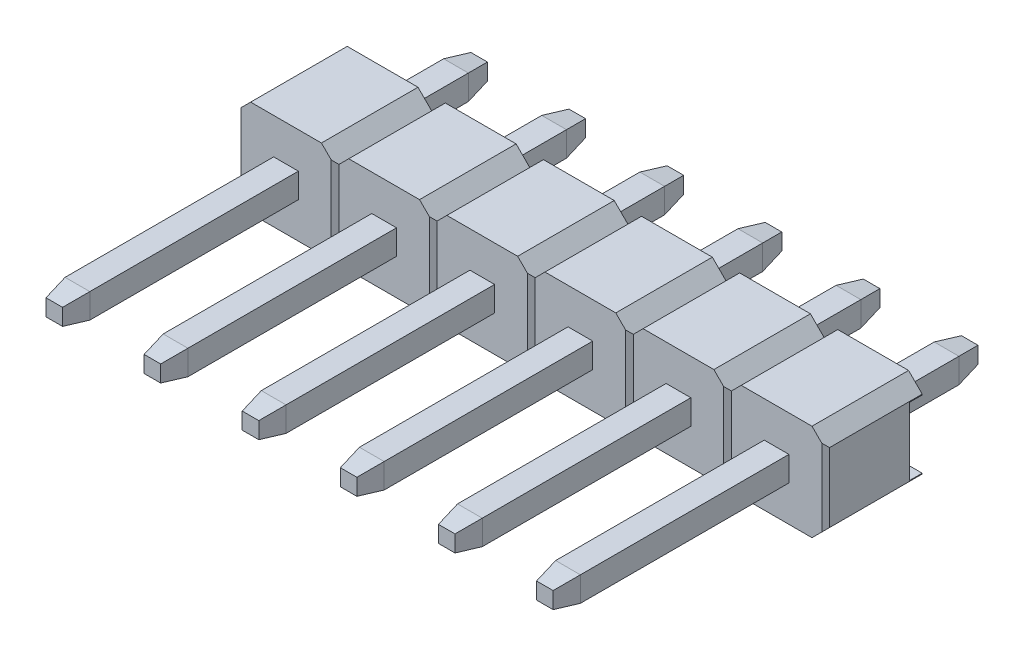
from build123d import *
from OCP.BRepFilletAPI import BRepFilletAPI_MakeChamfer

# Parameters (mm, degrees)
EXTRUDE1_DEPTH          = 1.25
CUT_EXTRUDE3_DEPTH      = 3.176671771
LPATTERN4_COUNT         = 6
LPATTERN4_PITCH         = 2.54
CUT_EXTRUDE1_DEPTH      = 15.081402629
CUT_EXTRUDE1_DEPTH_BACK = 15.081402629
SKETCH2_W               = 1.752893218
SKETCH2_H               = 0.33
SKETCH3_W               = 11
SKETCH3_H               = 0.64
EXTRUDE_THIN1_DEPTH     = 0.32
LPATTERN5_COUNT         = 6
LPATTERN5_PITCH         = 2.54
CHAMFER2_SIZE           = 0.6
CHAMFER2_SIZE2          = 0.105796188


with BuildPart() as part:
    # Sketch1 → Extrude1 (new, symmetric)
    with BuildSketch(Plane.XY):
        Polygon((-1.27, 0.896446609), (-0.916446609, 1.25), (0.916446609, 1.25), (1.27, 0.896446609), (1.27, -0.896446609), (0.916446609, -1.25), (-0.916446609, -1.25), (-1.27, -0.896446609), align=None)
    extrude1 = extrude(amount=EXTRUDE1_DEPTH, both=True)

    # Sketch4 → Cut-Extrude3 (cut, symmetric)
    with BuildSketch(Plane(origin=(0, 0, 0), x_dir=(1, 0, 0), z_dir=(0, 1, 0))):
        Polygon((-1.27, -1.15), (-1.17, -1.25), (-1.27, -1.25), align=None)
        Polygon((1.17, -1.25), (1.27, -1.15), (1.27, -1.25), align=None)
    cut_extrude3 = extrude(amount=CUT_EXTRUDE3_DEPTH, both=True, mode=Mode.SUBTRACT)

    # LPattern4: Extrude1, Cut-Extrude3 ×6
    with Locations(*[(-i * LPATTERN4_PITCH, 0, 0) for i in range(1, LPATTERN4_COUNT)]):
        add(extrude1)
        add(cut_extrude3, mode=Mode.SUBTRACT)

    # Sketch2 → Cut-Extrude1 (cut, two sides: drawn at the far end of the back side and taken through both)
    with BuildSketch(Plane(origin=(0, 0, 0), x_dir=(0, -1, 0), z_dir=(1, 0, 0)).offset(-CUT_EXTRUDE1_DEPTH_BACK)):
        with Locations((0, 1.085)):
            Rectangle(SKETCH2_W, SKETCH2_H)
    extrude(amount=CUT_EXTRUDE1_DEPTH + CUT_EXTRUDE1_DEPTH_BACK, mode=Mode.SUBTRACT)

    # Sketch3 → Extrude-Thin1 (add, symmetric)
    with BuildSketch(Plane(origin=(0, 0, 0), x_dir=(0, 0, -1), z_dir=(1, 0, 0))):
        with Locations((-1.75, 0)):
            Rectangle(SKETCH3_W, SKETCH3_H)
    extrude_thin1 = extrude(amount=EXTRUDE_THIN1_DEPTH, both=True)

    # LPattern5: Extrude-Thin1 ×6
    with Locations(*[(-i * LPATTERN5_PITCH, 0, 0) for i in range(1, LPATTERN5_COUNT)]):
        add(extrude_thin1)

    # Chamfer2: one chamfer whose edges measure the first distance from different faces: ONE call of the kernel's chamfer builder (chamfer() names one face for all edges)
    chamfer2_edges_1 = [part.edges().sort_by_distance(p)[0] for p in [
        (0.32, 0, 7.25),
    ]]
    chamfer2_side_1 = [part.faces().sort_by_distance(p)[0] for p in [
        (0.32, 0, 4.25),
    ]]
    chamfer2_edges_2 = [part.edges().sort_by_distance(p)[0] for p in [
        (0, -0.32, 7.25),
    ]]
    chamfer2_side_2 = [part.faces().sort_by_distance(p)[0] for p in [
        (0, -0.32, 4.25),
    ]]
    chamfer2_edges_3 = [part.edges().sort_by_distance(p)[0] for p in [
        (-0.32, 0, 7.25),
    ]]
    chamfer2_side_3 = [part.faces().sort_by_distance(p)[0] for p in [
        (-0.32, 0, 4.25),
    ]]
    chamfer2_edges_4 = [part.edges().sort_by_distance(p)[0] for p in [
        (0, 0.32, 7.25),
    ]]
    chamfer2_side_4 = [part.faces().sort_by_distance(p)[0] for p in [
        (0, 0.32, 4.25),
    ]]
    chamfer2_edges_5 = [part.edges().sort_by_distance(p)[0] for p in [
        (0.32, 0, -3.75),
    ]]
    chamfer2_side_5 = [part.faces().sort_by_distance(p)[0] for p in [
        (0.32, 0, -2.335),
    ]]
    chamfer2_edges_6 = [part.edges().sort_by_distance(p)[0] for p in [
        (-0.32, 0, -3.75),
    ]]
    chamfer2_side_6 = [part.faces().sort_by_distance(p)[0] for p in [
        (-0.32, 0, -2.335),
    ]]
    chamfer2_edges_7 = [part.edges().sort_by_distance(p)[0] for p in [
        (-4.76, 0, -3.75),
    ]]
    chamfer2_side_7 = [part.faces().sort_by_distance(p)[0] for p in [
        (-4.76, 0, -2.335),
    ]]
    chamfer2_edges_8 = [part.edges().sort_by_distance(p)[0] for p in [
        (-5.4, 0, -3.75),
    ]]
    chamfer2_side_8 = [part.faces().sort_by_distance(p)[0] for p in [
        (-5.4, 0, -2.335),
    ]]
    chamfer2_edges_9 = [part.edges().sort_by_distance(p)[0] for p in [
        (-2.22, 0, -3.75),
    ]]
    chamfer2_side_9 = [part.faces().sort_by_distance(p)[0] for p in [
        (-2.22, 0, -2.335),
    ]]
    chamfer2_edges_10 = [part.edges().sort_by_distance(p)[0] for p in [
        (-2.86, 0, -3.75),
    ]]
    chamfer2_side_10 = [part.faces().sort_by_distance(p)[0] for p in [
        (-2.86, 0, -2.335),
    ]]
    chamfer2_edges_11 = [part.edges().sort_by_distance(p)[0] for p in [
        (-2.22, 0, 7.25),
    ]]
    chamfer2_side_11 = [part.faces().sort_by_distance(p)[0] for p in [
        (-2.22, 0, 4.25),
    ]]
    chamfer2_edges_12 = [part.edges().sort_by_distance(p)[0] for p in [
        (-2.54, -0.32, 7.25),
    ]]
    chamfer2_side_12 = [part.faces().sort_by_distance(p)[0] for p in [
        (-2.54, -0.32, 4.25),
    ]]
    chamfer2_edges_13 = [part.edges().sort_by_distance(p)[0] for p in [
        (-2.86, 0, 7.25),
    ]]
    chamfer2_side_13 = [part.faces().sort_by_distance(p)[0] for p in [
        (-2.86, 0, 4.25),
    ]]
    chamfer2_edges_14 = [part.edges().sort_by_distance(p)[0] for p in [
        (-2.54, 0.32, 7.25),
    ]]
    chamfer2_side_14 = [part.faces().sort_by_distance(p)[0] for p in [
        (-2.54, 0.32, 4.25),
    ]]
    chamfer2_edges_15 = [part.edges().sort_by_distance(p)[0] for p in [
        (-4.76, 0, 7.25),
    ]]
    chamfer2_side_15 = [part.faces().sort_by_distance(p)[0] for p in [
        (-4.76, 0, 4.25),
    ]]
    chamfer2_edges_16 = [part.edges().sort_by_distance(p)[0] for p in [
        (-5.08, -0.32, 7.25),
    ]]
    chamfer2_side_16 = [part.faces().sort_by_distance(p)[0] for p in [
        (-5.08, -0.32, 4.25),
    ]]
    chamfer2_edges_17 = [part.edges().sort_by_distance(p)[0] for p in [
        (-5.4, 0, 7.25),
    ]]
    chamfer2_side_17 = [part.faces().sort_by_distance(p)[0] for p in [
        (-5.4, 0, 4.25),
    ]]
    chamfer2_edges_18 = [part.edges().sort_by_distance(p)[0] for p in [
        (-5.08, 0.32, 7.25),
    ]]
    chamfer2_side_18 = [part.faces().sort_by_distance(p)[0] for p in [
        (-5.08, 0.32, 4.25),
    ]]
    chamfer2_edges_19 = [part.edges().sort_by_distance(p)[0] for p in [
        (-2.54, 0.32, -3.75),
    ]]
    chamfer2_side_19 = [part.faces().sort_by_distance(p)[0] for p in [
        (-2.54, 0.32, -2.335),
    ]]
    chamfer2_edges_20 = [part.edges().sort_by_distance(p)[0] for p in [
        (-2.54, -0.32, -3.75),
    ]]
    chamfer2_side_20 = [part.faces().sort_by_distance(p)[0] for p in [
        (-2.54, -0.32, -2.335),
    ]]
    chamfer2_edges_21 = [part.edges().sort_by_distance(p)[0] for p in [
        (0, 0.32, -3.75),
    ]]
    chamfer2_side_21 = [part.faces().sort_by_distance(p)[0] for p in [
        (0, 0.32, -2.335),
    ]]
    chamfer2_edges_22 = [part.edges().sort_by_distance(p)[0] for p in [
        (0, -0.32, -3.75),
    ]]
    chamfer2_side_22 = [part.faces().sort_by_distance(p)[0] for p in [
        (0, -0.32, -2.335),
    ]]
    chamfer2_edges_23 = [part.edges().sort_by_distance(p)[0] for p in [
        (-9.84, 0, -3.75),
    ]]
    chamfer2_side_23 = [part.faces().sort_by_distance(p)[0] for p in [
        (-9.84, 0, -2.335),
    ]]
    chamfer2_edges_24 = [part.edges().sort_by_distance(p)[0] for p in [
        (-10.16, 0.32, -3.75),
    ]]
    chamfer2_side_24 = [part.faces().sort_by_distance(p)[0] for p in [
        (-10.16, 0.32, -2.335),
    ]]
    chamfer2_edges_25 = [part.edges().sort_by_distance(p)[0] for p in [
        (-10.48, 0, -3.75),
    ]]
    chamfer2_side_25 = [part.faces().sort_by_distance(p)[0] for p in [
        (-10.48, 0, -2.335),
    ]]
    chamfer2_edges_26 = [part.edges().sort_by_distance(p)[0] for p in [
        (-10.16, -0.32, -3.75),
    ]]
    chamfer2_side_26 = [part.faces().sort_by_distance(p)[0] for p in [
        (-10.16, -0.32, -2.335),
    ]]
    chamfer2_edges_27 = [part.edges().sort_by_distance(p)[0] for p in [
        (-7.3, 0, -3.75),
    ]]
    chamfer2_side_27 = [part.faces().sort_by_distance(p)[0] for p in [
        (-7.3, 0, -2.335),
    ]]
    chamfer2_edges_28 = [part.edges().sort_by_distance(p)[0] for p in [
        (-7.62, 0.32, -3.75),
    ]]
    chamfer2_side_28 = [part.faces().sort_by_distance(p)[0] for p in [
        (-7.62, 0.32, -2.335),
    ]]
    chamfer2_edges_29 = [part.edges().sort_by_distance(p)[0] for p in [
        (-7.94, 0, -3.75),
    ]]
    chamfer2_side_29 = [part.faces().sort_by_distance(p)[0] for p in [
        (-7.94, 0, -2.335),
    ]]
    chamfer2_edges_30 = [part.edges().sort_by_distance(p)[0] for p in [
        (-7.62, -0.32, -3.75),
    ]]
    chamfer2_side_30 = [part.faces().sort_by_distance(p)[0] for p in [
        (-7.62, -0.32, -2.335),
    ]]
    chamfer2_edges_31 = [part.edges().sort_by_distance(p)[0] for p in [
        (-5.08, 0.32, -3.75),
    ]]
    chamfer2_side_31 = [part.faces().sort_by_distance(p)[0] for p in [
        (-5.08, 0.32, -2.335),
    ]]
    chamfer2_edges_32 = [part.edges().sort_by_distance(p)[0] for p in [
        (-5.08, -0.32, -3.75),
    ]]
    chamfer2_side_32 = [part.faces().sort_by_distance(p)[0] for p in [
        (-5.08, -0.32, -2.335),
    ]]
    chamfer2_edges_33 = [part.edges().sort_by_distance(p)[0] for p in [
        (-9.84, 0, 7.25),
    ]]
    chamfer2_side_33 = [part.faces().sort_by_distance(p)[0] for p in [
        (-9.84, 0, 4.25),
    ]]
    chamfer2_edges_34 = [part.edges().sort_by_distance(p)[0] for p in [
        (-10.16, -0.32, 7.25),
    ]]
    chamfer2_side_34 = [part.faces().sort_by_distance(p)[0] for p in [
        (-10.16, -0.32, 4.25),
    ]]
    chamfer2_edges_35 = [part.edges().sort_by_distance(p)[0] for p in [
        (-10.48, 0, 7.25),
    ]]
    chamfer2_side_35 = [part.faces().sort_by_distance(p)[0] for p in [
        (-10.48, 0, 4.25),
    ]]
    chamfer2_edges_36 = [part.edges().sort_by_distance(p)[0] for p in [
        (-10.16, 0.32, 7.25),
    ]]
    chamfer2_side_36 = [part.faces().sort_by_distance(p)[0] for p in [
        (-10.16, 0.32, 4.25),
    ]]
    chamfer2_edges_37 = [part.edges().sort_by_distance(p)[0] for p in [
        (-7.3, 0, 7.25),
    ]]
    chamfer2_side_37 = [part.faces().sort_by_distance(p)[0] for p in [
        (-7.3, 0, 4.25),
    ]]
    chamfer2_edges_38 = [part.edges().sort_by_distance(p)[0] for p in [
        (-7.62, -0.32, 7.25),
    ]]
    chamfer2_side_38 = [part.faces().sort_by_distance(p)[0] for p in [
        (-7.62, -0.32, 4.25),
    ]]
    chamfer2_edges_39 = [part.edges().sort_by_distance(p)[0] for p in [
        (-7.94, 0, 7.25),
    ]]
    chamfer2_side_39 = [part.faces().sort_by_distance(p)[0] for p in [
        (-7.94, 0, 4.25),
    ]]
    chamfer2_edges_40 = [part.edges().sort_by_distance(p)[0] for p in [
        (-7.62, 0.32, 7.25),
    ]]
    chamfer2_side_40 = [part.faces().sort_by_distance(p)[0] for p in [
        (-7.62, 0.32, 4.25),
    ]]
    chamfer2_edges_41 = [part.edges().sort_by_distance(p)[0] for p in [
        (-12.38, 0, -3.75),
    ]]
    chamfer2_side_41 = [part.faces().sort_by_distance(p)[0] for p in [
        (-12.38, 0, -2.335),
    ]]
    chamfer2_edges_42 = [part.edges().sort_by_distance(p)[0] for p in [
        (-12.7, 0.32, -3.75),
    ]]
    chamfer2_side_42 = [part.faces().sort_by_distance(p)[0] for p in [
        (-12.7, 0.32, -2.335),
    ]]
    chamfer2_edges_43 = [part.edges().sort_by_distance(p)[0] for p in [
        (-13.02, 0, -3.75),
    ]]
    chamfer2_side_43 = [part.faces().sort_by_distance(p)[0] for p in [
        (-13.02, 0, -2.335),
    ]]
    chamfer2_edges_44 = [part.edges().sort_by_distance(p)[0] for p in [
        (-12.7, -0.32, -3.75),
    ]]
    chamfer2_side_44 = [part.faces().sort_by_distance(p)[0] for p in [
        (-12.7, -0.32, -2.335),
    ]]
    chamfer2_edges_45 = [part.edges().sort_by_distance(p)[0] for p in [
        (-12.38, 0, 7.25),
    ]]
    chamfer2_side_45 = [part.faces().sort_by_distance(p)[0] for p in [
        (-12.38, 0, 4.25),
    ]]
    chamfer2_edges_46 = [part.edges().sort_by_distance(p)[0] for p in [
        (-12.7, -0.32, 7.25),
    ]]
    chamfer2_side_46 = [part.faces().sort_by_distance(p)[0] for p in [
        (-12.7, -0.32, 4.25),
    ]]
    chamfer2_edges_47 = [part.edges().sort_by_distance(p)[0] for p in [
        (-13.02, 0, 7.25),
    ]]
    chamfer2_side_47 = [part.faces().sort_by_distance(p)[0] for p in [
        (-13.02, 0, 4.25),
    ]]
    chamfer2_edges_48 = [part.edges().sort_by_distance(p)[0] for p in [
        (-12.7, 0.32, 7.25),
    ]]
    chamfer2_side_48 = [part.faces().sort_by_distance(p)[0] for p in [
        (-12.7, 0.32, 4.25),
    ]]
    chamfer2 = BRepFilletAPI_MakeChamfer(part.part.solid().wrapped)
    for e in chamfer2_edges_1:
        chamfer2.Add(CHAMFER2_SIZE, CHAMFER2_SIZE2, e.wrapped, chamfer2_side_1[0].wrapped)  # the first distance lies on this face
    for e in chamfer2_edges_2:
        chamfer2.Add(CHAMFER2_SIZE, CHAMFER2_SIZE2, e.wrapped, chamfer2_side_2[0].wrapped)  # the first distance lies on this face
    for e in chamfer2_edges_3:
        chamfer2.Add(CHAMFER2_SIZE, CHAMFER2_SIZE2, e.wrapped, chamfer2_side_3[0].wrapped)  # the first distance lies on this face
    for e in chamfer2_edges_4:
        chamfer2.Add(CHAMFER2_SIZE, CHAMFER2_SIZE2, e.wrapped, chamfer2_side_4[0].wrapped)  # the first distance lies on this face
    for e in chamfer2_edges_5:
        chamfer2.Add(CHAMFER2_SIZE, CHAMFER2_SIZE2, e.wrapped, chamfer2_side_5[0].wrapped)  # the first distance lies on this face
    for e in chamfer2_edges_6:
        chamfer2.Add(CHAMFER2_SIZE, CHAMFER2_SIZE2, e.wrapped, chamfer2_side_6[0].wrapped)  # the first distance lies on this face
    for e in chamfer2_edges_7:
        chamfer2.Add(CHAMFER2_SIZE, CHAMFER2_SIZE2, e.wrapped, chamfer2_side_7[0].wrapped)  # the first distance lies on this face
    for e in chamfer2_edges_8:
        chamfer2.Add(CHAMFER2_SIZE, CHAMFER2_SIZE2, e.wrapped, chamfer2_side_8[0].wrapped)  # the first distance lies on this face
    for e in chamfer2_edges_9:
        chamfer2.Add(CHAMFER2_SIZE, CHAMFER2_SIZE2, e.wrapped, chamfer2_side_9[0].wrapped)  # the first distance lies on this face
    for e in chamfer2_edges_10:
        chamfer2.Add(CHAMFER2_SIZE, CHAMFER2_SIZE2, e.wrapped, chamfer2_side_10[0].wrapped)  # the first distance lies on this face
    for e in chamfer2_edges_11:
        chamfer2.Add(CHAMFER2_SIZE, CHAMFER2_SIZE2, e.wrapped, chamfer2_side_11[0].wrapped)  # the first distance lies on this face
    for e in chamfer2_edges_12:
        chamfer2.Add(CHAMFER2_SIZE, CHAMFER2_SIZE2, e.wrapped, chamfer2_side_12[0].wrapped)  # the first distance lies on this face
    for e in chamfer2_edges_13:
        chamfer2.Add(CHAMFER2_SIZE, CHAMFER2_SIZE2, e.wrapped, chamfer2_side_13[0].wrapped)  # the first distance lies on this face
    for e in chamfer2_edges_14:
        chamfer2.Add(CHAMFER2_SIZE, CHAMFER2_SIZE2, e.wrapped, chamfer2_side_14[0].wrapped)  # the first distance lies on this face
    for e in chamfer2_edges_15:
        chamfer2.Add(CHAMFER2_SIZE, CHAMFER2_SIZE2, e.wrapped, chamfer2_side_15[0].wrapped)  # the first distance lies on this face
    for e in chamfer2_edges_16:
        chamfer2.Add(CHAMFER2_SIZE, CHAMFER2_SIZE2, e.wrapped, chamfer2_side_16[0].wrapped)  # the first distance lies on this face
    for e in chamfer2_edges_17:
        chamfer2.Add(CHAMFER2_SIZE, CHAMFER2_SIZE2, e.wrapped, chamfer2_side_17[0].wrapped)  # the first distance lies on this face
    for e in chamfer2_edges_18:
        chamfer2.Add(CHAMFER2_SIZE, CHAMFER2_SIZE2, e.wrapped, chamfer2_side_18[0].wrapped)  # the first distance lies on this face
    for e in chamfer2_edges_19:
        chamfer2.Add(CHAMFER2_SIZE, CHAMFER2_SIZE2, e.wrapped, chamfer2_side_19[0].wrapped)  # the first distance lies on this face
    for e in chamfer2_edges_20:
        chamfer2.Add(CHAMFER2_SIZE, CHAMFER2_SIZE2, e.wrapped, chamfer2_side_20[0].wrapped)  # the first distance lies on this face
    for e in chamfer2_edges_21:
        chamfer2.Add(CHAMFER2_SIZE, CHAMFER2_SIZE2, e.wrapped, chamfer2_side_21[0].wrapped)  # the first distance lies on this face
    for e in chamfer2_edges_22:
        chamfer2.Add(CHAMFER2_SIZE, CHAMFER2_SIZE2, e.wrapped, chamfer2_side_22[0].wrapped)  # the first distance lies on this face
    for e in chamfer2_edges_23:
        chamfer2.Add(CHAMFER2_SIZE, CHAMFER2_SIZE2, e.wrapped, chamfer2_side_23[0].wrapped)  # the first distance lies on this face
    for e in chamfer2_edges_24:
        chamfer2.Add(CHAMFER2_SIZE, CHAMFER2_SIZE2, e.wrapped, chamfer2_side_24[0].wrapped)  # the first distance lies on this face
    for e in chamfer2_edges_25:
        chamfer2.Add(CHAMFER2_SIZE, CHAMFER2_SIZE2, e.wrapped, chamfer2_side_25[0].wrapped)  # the first distance lies on this face
    for e in chamfer2_edges_26:
        chamfer2.Add(CHAMFER2_SIZE, CHAMFER2_SIZE2, e.wrapped, chamfer2_side_26[0].wrapped)  # the first distance lies on this face
    for e in chamfer2_edges_27:
        chamfer2.Add(CHAMFER2_SIZE, CHAMFER2_SIZE2, e.wrapped, chamfer2_side_27[0].wrapped)  # the first distance lies on this face
    for e in chamfer2_edges_28:
        chamfer2.Add(CHAMFER2_SIZE, CHAMFER2_SIZE2, e.wrapped, chamfer2_side_28[0].wrapped)  # the first distance lies on this face
    for e in chamfer2_edges_29:
        chamfer2.Add(CHAMFER2_SIZE, CHAMFER2_SIZE2, e.wrapped, chamfer2_side_29[0].wrapped)  # the first distance lies on this face
    for e in chamfer2_edges_30:
        chamfer2.Add(CHAMFER2_SIZE, CHAMFER2_SIZE2, e.wrapped, chamfer2_side_30[0].wrapped)  # the first distance lies on this face
    for e in chamfer2_edges_31:
        chamfer2.Add(CHAMFER2_SIZE, CHAMFER2_SIZE2, e.wrapped, chamfer2_side_31[0].wrapped)  # the first distance lies on this face
    for e in chamfer2_edges_32:
        chamfer2.Add(CHAMFER2_SIZE, CHAMFER2_SIZE2, e.wrapped, chamfer2_side_32[0].wrapped)  # the first distance lies on this face
    for e in chamfer2_edges_33:
        chamfer2.Add(CHAMFER2_SIZE, CHAMFER2_SIZE2, e.wrapped, chamfer2_side_33[0].wrapped)  # the first distance lies on this face
    for e in chamfer2_edges_34:
        chamfer2.Add(CHAMFER2_SIZE, CHAMFER2_SIZE2, e.wrapped, chamfer2_side_34[0].wrapped)  # the first distance lies on this face
    for e in chamfer2_edges_35:
        chamfer2.Add(CHAMFER2_SIZE, CHAMFER2_SIZE2, e.wrapped, chamfer2_side_35[0].wrapped)  # the first distance lies on this face
    for e in chamfer2_edges_36:
        chamfer2.Add(CHAMFER2_SIZE, CHAMFER2_SIZE2, e.wrapped, chamfer2_side_36[0].wrapped)  # the first distance lies on this face
    for e in chamfer2_edges_37:
        chamfer2.Add(CHAMFER2_SIZE, CHAMFER2_SIZE2, e.wrapped, chamfer2_side_37[0].wrapped)  # the first distance lies on this face
    for e in chamfer2_edges_38:
        chamfer2.Add(CHAMFER2_SIZE, CHAMFER2_SIZE2, e.wrapped, chamfer2_side_38[0].wrapped)  # the first distance lies on this face
    for e in chamfer2_edges_39:
        chamfer2.Add(CHAMFER2_SIZE, CHAMFER2_SIZE2, e.wrapped, chamfer2_side_39[0].wrapped)  # the first distance lies on this face
    for e in chamfer2_edges_40:
        chamfer2.Add(CHAMFER2_SIZE, CHAMFER2_SIZE2, e.wrapped, chamfer2_side_40[0].wrapped)  # the first distance lies on this face
    for e in chamfer2_edges_41:
        chamfer2.Add(CHAMFER2_SIZE, CHAMFER2_SIZE2, e.wrapped, chamfer2_side_41[0].wrapped)  # the first distance lies on this face
    for e in chamfer2_edges_42:
        chamfer2.Add(CHAMFER2_SIZE, CHAMFER2_SIZE2, e.wrapped, chamfer2_side_42[0].wrapped)  # the first distance lies on this face
    for e in chamfer2_edges_43:
        chamfer2.Add(CHAMFER2_SIZE, CHAMFER2_SIZE2, e.wrapped, chamfer2_side_43[0].wrapped)  # the first distance lies on this face
    for e in chamfer2_edges_44:
        chamfer2.Add(CHAMFER2_SIZE, CHAMFER2_SIZE2, e.wrapped, chamfer2_side_44[0].wrapped)  # the first distance lies on this face
    for e in chamfer2_edges_45:
        chamfer2.Add(CHAMFER2_SIZE, CHAMFER2_SIZE2, e.wrapped, chamfer2_side_45[0].wrapped)  # the first distance lies on this face
    for e in chamfer2_edges_46:
        chamfer2.Add(CHAMFER2_SIZE, CHAMFER2_SIZE2, e.wrapped, chamfer2_side_46[0].wrapped)  # the first distance lies on this face
    for e in chamfer2_edges_47:
        chamfer2.Add(CHAMFER2_SIZE, CHAMFER2_SIZE2, e.wrapped, chamfer2_side_47[0].wrapped)  # the first distance lies on this face
    for e in chamfer2_edges_48:
        chamfer2.Add(CHAMFER2_SIZE, CHAMFER2_SIZE2, e.wrapped, chamfer2_side_48[0].wrapped)  # the first distance lies on this face
    add(Compound.cast(chamfer2.Shape()), mode=Mode.REPLACE)


solid = part.part
